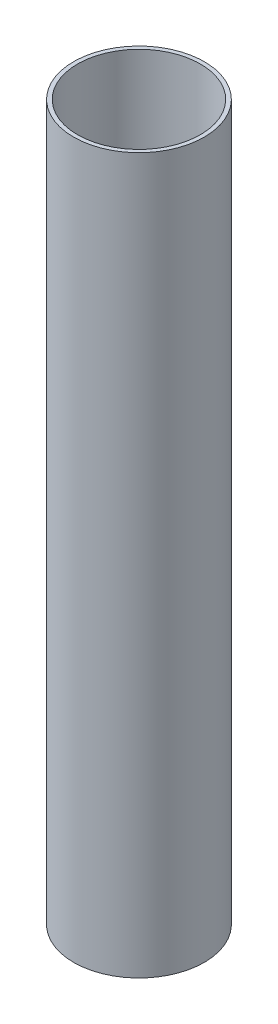
from build123d import *

# Parameters (mm, degrees)
SKETCH1_R           = 27
SKETCH1_R_2         = 25.35
BOSS_EXTRUDE1_DEPTH = 295.275


with BuildPart() as part:
    # Sketch1 → Boss-Extrude1 (new body)
    with BuildSketch(Plane(origin=(0, 0, 0), x_dir=(1, 0, 0), z_dir=(0, 1, 0))):
        with Locations(Location((0, 0, 0), (0, 0, 270))):
            Circle(SKETCH1_R)
        with Locations(Location((0, 0, 0), (0, 0, 270))):
            Circle(SKETCH1_R_2, mode=Mode.SUBTRACT)
    extrude(amount=BOSS_EXTRUDE1_DEPTH)


solid = part.part
